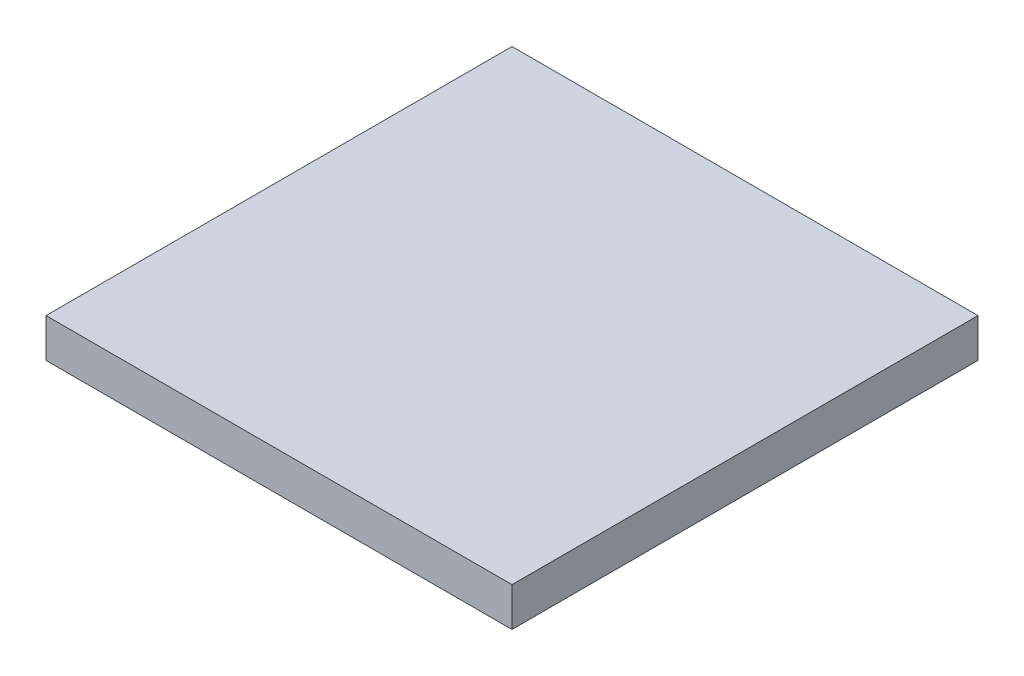
from build123d import *

# Parameters (mm, degrees)
CROQUIS1_W              = 180
CROQUIS1_H              = 180
SALIENTE_EXTRUIR1_DEPTH = 15


with BuildPart() as part:
    # Croquis1 → Saliente-Extruir1 (new body)
    with BuildSketch(Plane(origin=(0, 0, 0), x_dir=(1, 0, 0), z_dir=(0, 1, 0))):
        with Locations((28.556314389, -44.245413514)):
            Rectangle(CROQUIS1_W, CROQUIS1_H)
    extrude(amount=SALIENTE_EXTRUIR1_DEPTH)


solid = part.part
